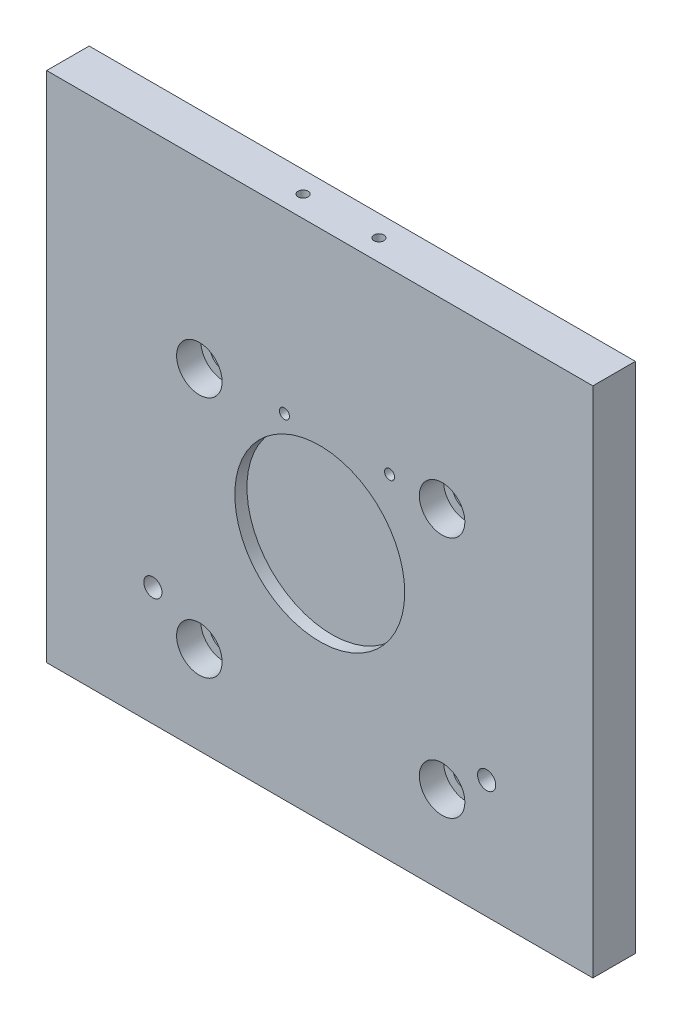
from build123d import *

# Parameters (mm, degrees)
SKETCH1_W                               = 180
SKETCH1_H                               = 169
BOSS_EXTRUDE1_DEPTH                     = 14
F_6_0_6_DIAMETER_HOLE1_D                = 6
F_6_0_6_DIAMETER_HOLE1_DEPTH            = 10
M48_CLEARANCE_HOLE1_D                   = 56
M48_CLEARANCE_HOLE1_DEPTH               = 4
F_3_3_3_3_DIAMETER_HOLE1_D              = 3.3
F_3_3_3_3_DIAMETER_HOLE1_DEPTH          = 8
CBORE_FOR_M8_HEX_HEAD_BOLT1_D           = 9
CBORE_FOR_M8_HEX_HEAD_BOLT1_CBORE_D     = 15
CBORE_FOR_M8_HEX_HEAD_BOLT1_CBORE_DEPTH = 8
F_3_3_3_3_DIAMETER_HOLE2_D              = 3.3
F_3_3_3_3_DIAMETER_HOLE2_DEPTH          = 10


with BuildPart() as part:
    # Sketch1 → Boss-Extrude1 (new body)
    with BuildSketch(Plane.XY.offset(14)):
        with Locations((0, 5.5)):
            Rectangle(SKETCH1_W, SKETCH1_H)
    extrude(amount=-BOSS_EXTRUDE1_DEPTH)

    # Ø6.0 (6) Diameter Hole1
    with Locations(Plane.XY.offset(14)):
        with Locations((55, -40), (-55, -40)):
            Hole(F_6_0_6_DIAMETER_HOLE1_D / 2, depth=F_6_0_6_DIAMETER_HOLE1_DEPTH)

    # M48 Clearance Hole1
    with Locations(Plane.XY.offset(14)):
        with Locations((0, 0)):
            Hole(M48_CLEARANCE_HOLE1_D / 2, depth=M48_CLEARANCE_HOLE1_DEPTH)

    # Ø3.3 (3.3) Diameter Hole1
    with Locations(Plane.XY.offset(14)):
        with Locations((23, 31.25), (-11.64, 31.25)):
            Hole(F_3_3_3_3_DIAMETER_HOLE1_D / 2, depth=F_3_3_3_3_DIAMETER_HOLE1_DEPTH)

    # CBORE for M8 Hex Head Bolt1 (through all)
    with Locations(Plane.XY.offset(14)):
        with Locations((40.316, 30.077), (-39.684, 30.077), (40.316, -49.923), (-39.684, -49.923)):
            CounterBoreHole(CBORE_FOR_M8_HEX_HEAD_BOLT1_D / 2, CBORE_FOR_M8_HEX_HEAD_BOLT1_CBORE_D / 2, CBORE_FOR_M8_HEX_HEAD_BOLT1_CBORE_DEPTH)

    # Ø3.3 (3.3) Diameter Hole2
    with Locations(Plane(origin=(0, 90, 0), x_dir=(1, 0, 0), z_dir=(0, 1, 0))):
        with Locations((-12.5, -7), (12.5, -7)):
            Hole(F_3_3_3_3_DIAMETER_HOLE2_D / 2, depth=F_3_3_3_3_DIAMETER_HOLE2_DEPTH)


solid = part.part
